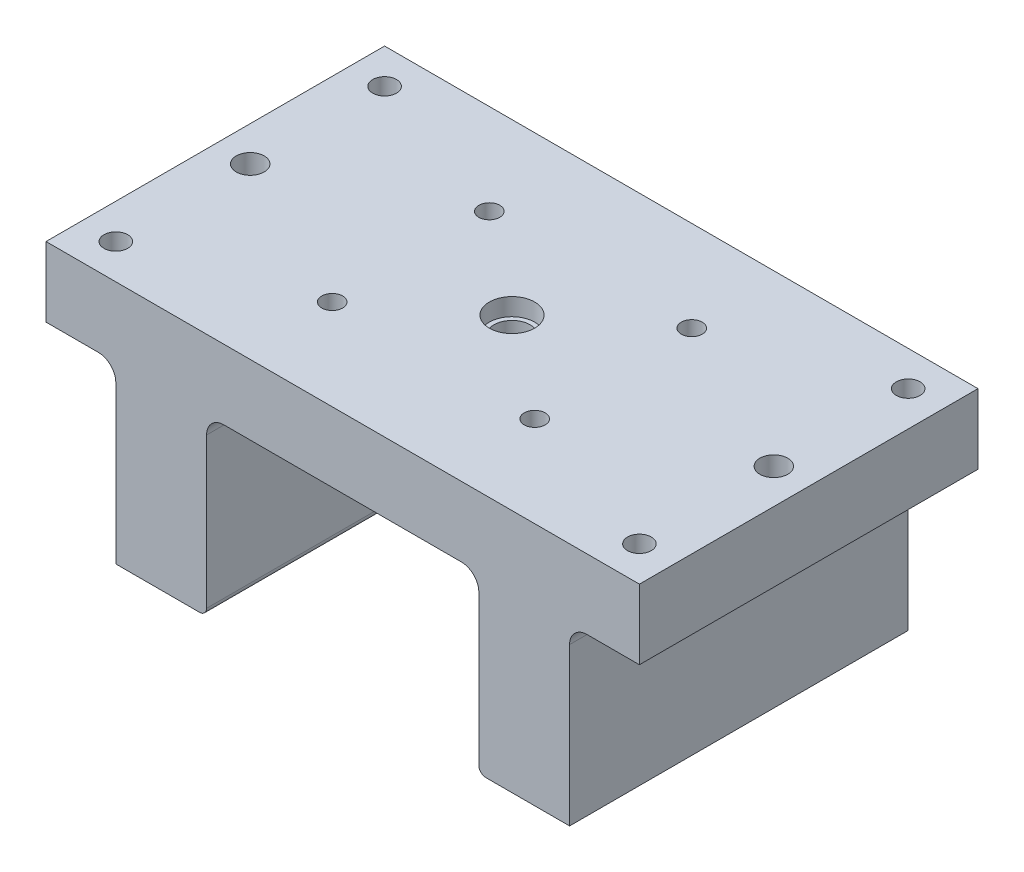
from build123d import *

# Parameters (mm, degrees)
SKETCH1_W                = 130
SKETCH1_H                = 97
BOSS_EXTRUDE1_DEPTH      = 70
SKETCH2_W                = 78
SKETCH2_H                = 50
CUT_EXTRUDE1_DEPTH       = 137.1396342
FILLET3_R                = 5
SKETCH3_R                = 5.2
CUT_EXTRUDE2_DEPTH       = 108.131928014
SKETCH4_R                = 6.5
CUT_EXTRUDE3_DEPTH       = 5
FILLET4_R                = 2
F_5_0_5_DIAMETER_HOLE1_D = 6
SKETCH8_W                = 20
SKETCH8_H                = 97
BOSS_EXTRUDE2_DEPTH      = 20
FILLET5_R                = 5
M8_TAPPED_HOLE1_D        = 6.8
F_8_0MM_DOWEL_HOLE1_D    = 8


with BuildPart() as part:
    # Sketch1 → Boss-Extrude1 (new body)
    with BuildSketch(Plane(origin=(0, 0, 0), x_dir=(1, 0, 0), z_dir=(0, 1, 0))):
        Rectangle(SKETCH1_W, SKETCH1_H)
    extrude(amount=BOSS_EXTRUDE1_DEPTH)

    # Sketch2 → Cut-Extrude1 (cut, through all)
    with BuildSketch(Plane.XY.offset(48.5)):
        with Locations((0, 25)):
            Rectangle(SKETCH2_W, SKETCH2_H)
    extrude(amount=-CUT_EXTRUDE1_DEPTH, mode=Mode.SUBTRACT)

    # Fillet3
    fillet3_edges = [part.edges().sort_by_distance(p)[0] for p in [
        (-39, 50, 0),
        (39, 50, 0),
    ]]
    fillet(fillet3_edges, radius=FILLET3_R)

    # Sketch3 → Cut-Extrude2 (cut, through all)
    with BuildSketch(Plane(origin=(0, 70, 0), x_dir=(1, 0, 0), z_dir=(0, 1, 0))):
        with Locations(Location((0, 0, 0), (0, 0, 270))):
            Circle(SKETCH3_R)
    extrude(amount=-CUT_EXTRUDE2_DEPTH, mode=Mode.SUBTRACT)

    # Sketch4 → Cut-Extrude3 (cut)
    with BuildSketch(Plane(origin=(0, 70, 0), x_dir=(1, 0, 0), z_dir=(0, 1, 0))):
        with Locations(Location((0, 0, 0), (0, 0, 270))):
            Circle(SKETCH4_R)
    extrude(amount=-CUT_EXTRUDE3_DEPTH, mode=Mode.SUBTRACT)

    # Fillet4
    fillet4_edges = [part.edges().sort_by_distance(p)[0] for p in [
        (-39, 0, 0),
        (39, 0, 0),
    ]]
    fillet(fillet4_edges, radius=FILLET4_R)

    # Ø5.0 (5) Diameter Hole1 (through all)
    with Locations(Plane(origin=(0, 70, 0), x_dir=(1, 0, 0), z_dir=(0, 1, 0))):
        with Locations((-29, 22.5), (29, 22.5), (29, -22.5), (-29, -22.5)):
            Hole(F_5_0_5_DIAMETER_HOLE1_D / 2)

    # Sketch8 → Boss-Extrude2 (add)
    with BuildSketch(Plane(origin=(0, 70, 0), x_dir=(1, 0, 0), z_dir=(0, 1, 0))):
        with Locations((-75, 0)):
            Rectangle(SKETCH8_W, SKETCH8_H)
    boss_extrude2 = extrude(amount=-BOSS_EXTRUDE2_DEPTH)

    # Mirror1: Boss-Extrude2 across plane
    add(boss_extrude2.mirror(Plane(origin=(0, 0, 0), x_dir=(0, 0, 1), z_dir=(1, 0, 0))))

    # Fillet5
    fillet5_edges = [part.edges().sort_by_distance(p)[0] for p in [
        (65, 50, 0),
        (-65, 50, 0),
    ]]
    fillet(fillet5_edges, radius=FILLET5_R)

    # M8 Tapped Hole1 (through all)
    with Locations(Plane(origin=(0, 70, 0), x_dir=(1, 0, 0), z_dir=(0, 1, 0))):
        with Locations((-75, 38.5), (-75, -38.5), (75, -38.5), (75, 38.5)):
            Hole(M8_TAPPED_HOLE1_D / 2)

    # Ø8.0mm Dowel Hole1 (through all)
    with Locations(Plane(origin=(0, 70, 0), x_dir=(1, 0, 0), z_dir=(0, 1, 0))):
        with Locations((-75, 0), (75, 0)):
            Hole(F_8_0MM_DOWEL_HOLE1_D / 2)


solid = part.part
